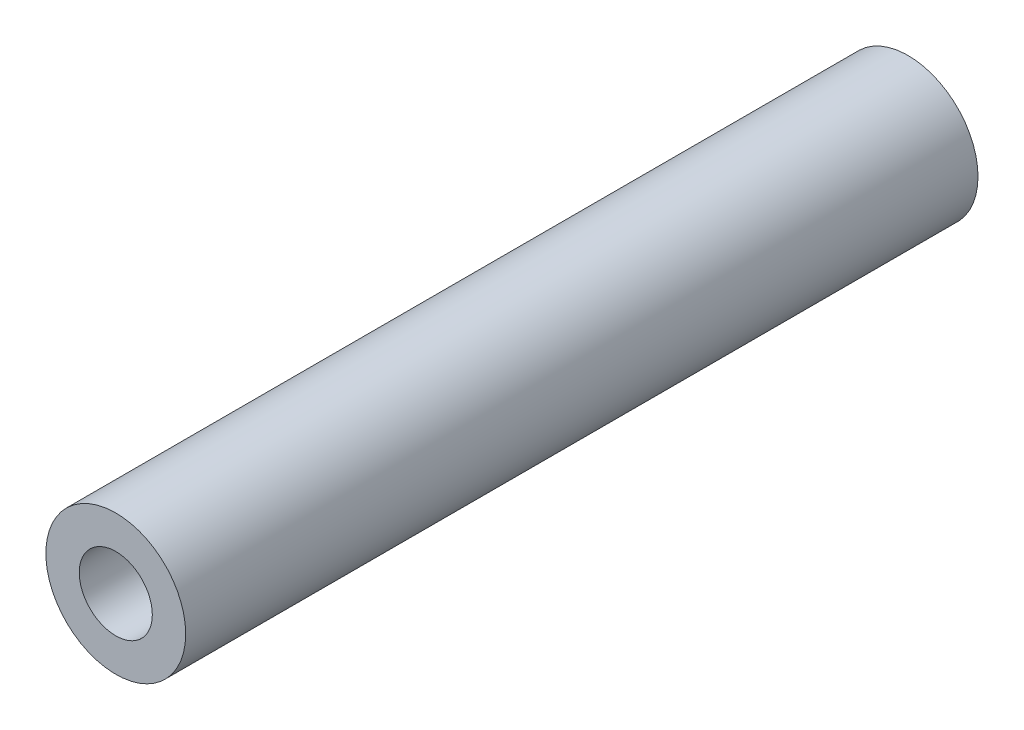
from build123d import *

# Parameters (mm, degrees)
SKETCH1_R           = 4.7625
SKETCH1_R_2         = 2.4892
BOSS_EXTRUDE1_DEPTH = 53.975


with BuildPart() as part:
    # Sketch1 → Boss-Extrude1 (new body)
    with BuildSketch(Plane.XY):
        Circle(SKETCH1_R)
        Circle(SKETCH1_R_2, mode=Mode.SUBTRACT)
    extrude(amount=BOSS_EXTRUDE1_DEPTH)


solid = part.part
